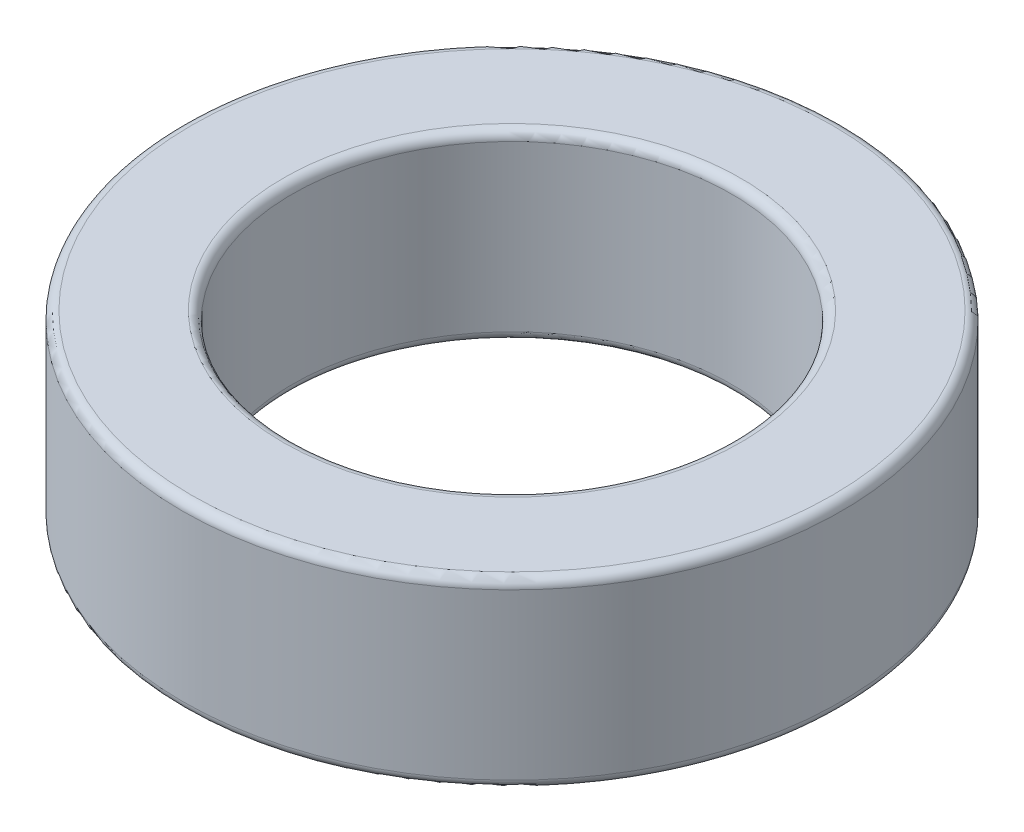
from build123d import *

# Parameters (mm, degrees)
SKETCH_1_R      = 9
SKETCH_1_R_2    = 6
EXTRUDE_1_DEPTH = 5
FILLET_1_R      = 0.25


with BuildPart() as part:
    # 草图1 → 凸台-拉伸1 (new body)
    with BuildSketch(Plane(origin=(0, 0, 0), x_dir=(1, 0, 0), z_dir=(0, 1, 0))):
        with Locations(Location((0, 0, 0), (0, 0, 270))):
            Circle(SKETCH_1_R)
        with Locations(Location((0, 0, 0), (0, 0, 270))):
            Circle(SKETCH_1_R_2, mode=Mode.SUBTRACT)
    extrude(amount=EXTRUDE_1_DEPTH)

    # 圆角1
    fillet_1_edges = [part.edges().sort_by_distance(p)[0] for p in [
        (0, 0, -9),
        (0, 5, -9),
        (0, 0, -6),
        (0, 5, -6),
    ]]
    fillet(fillet_1_edges, radius=FILLET_1_R)


solid = part.part
